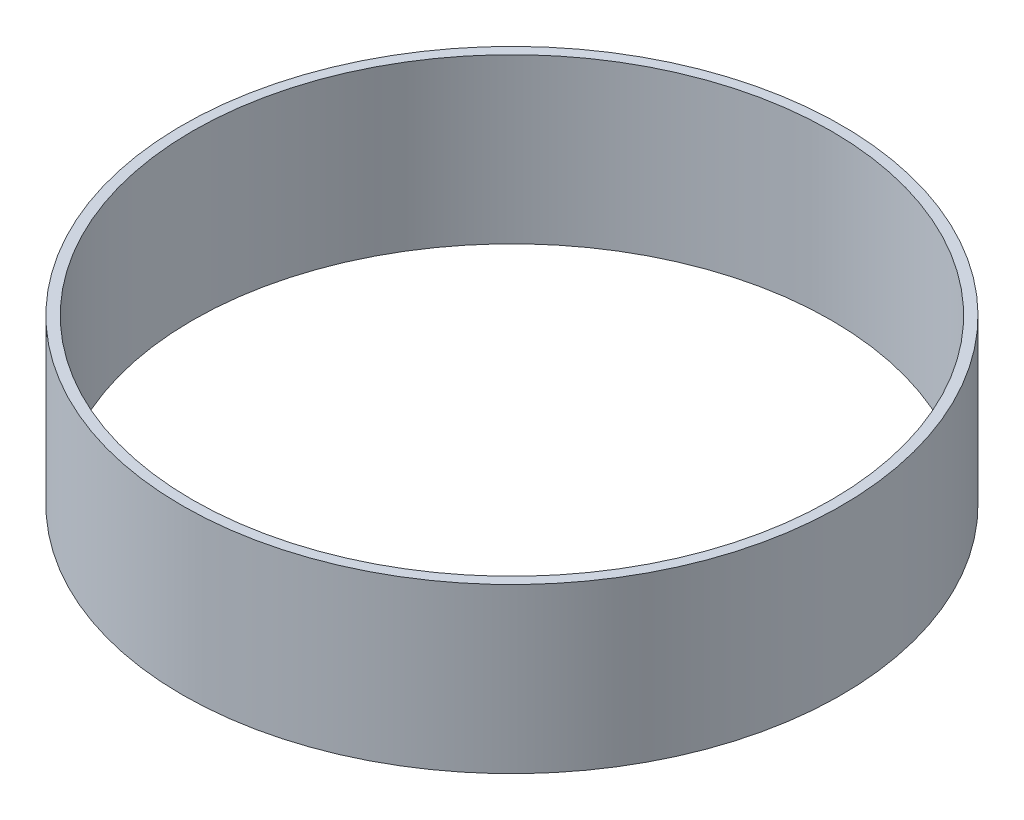
from build123d import *

# Parameters (mm, degrees)
SKETCH1_R           = 51.1048
SKETCH1_R_2         = 49.53
BOSS_EXTRUDE1_DEPTH = 25.4


with BuildPart() as part:
    # Sketch1 → Boss-Extrude1 (new body)
    with BuildSketch(Plane(origin=(0, 0, 0), x_dir=(1, 0, 0), z_dir=(0, 1, 0))):
        with Locations(Location((0, 0, 0), (0, 0, 270))):
            Circle(SKETCH1_R)
        with Locations(Location((0, 0, 0), (0, 0, 270))):
            Circle(SKETCH1_R_2, mode=Mode.SUBTRACT)
    extrude(amount=BOSS_EXTRUDE1_DEPTH)


solid = part.part
